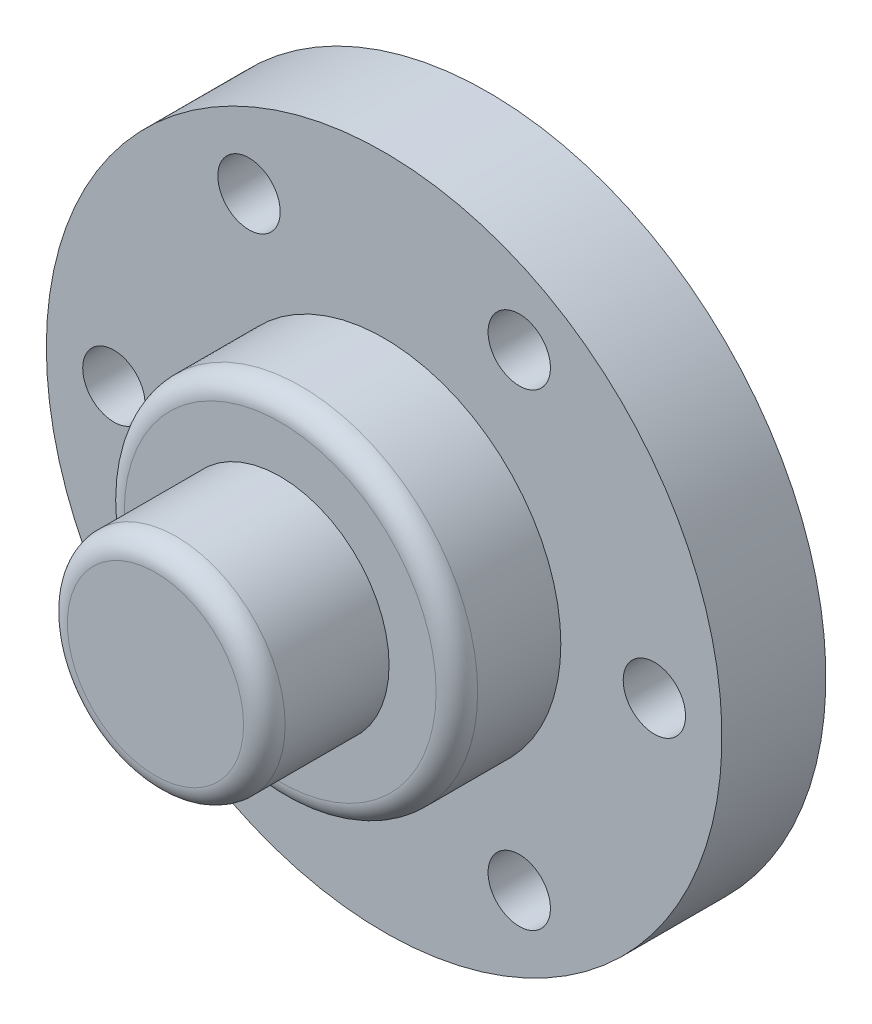
from build123d import *

# Parameters (mm, degrees)
SKETCH1_R           = 17
BOSS_EXTRUDE1_DEPTH = 10
SKETCH2_R           = 10.475
BOSS_EXTRUDE2_DEPTH = 12
FILLET1_R           = 2
SKETCH3_R           = 32.5
BOSS_EXTRUDE3_DEPTH = 10
SKETCH4_R           = 3
CUT_EXTRUDE1_DEPTH  = 57.004464108


with BuildPart() as part:
    # Sketch1 → Boss-Extrude1 (new body)
    with BuildSketch(Plane.XY):
        Circle(SKETCH1_R)
    extrude(amount=BOSS_EXTRUDE1_DEPTH)

    # Sketch2 → Boss-Extrude2 (add)
    with BuildSketch(Plane.XY.offset(10)):
        Circle(SKETCH2_R)
    extrude(amount=BOSS_EXTRUDE2_DEPTH)

    # Fillet1
    fillet1_edges = [part.edges().sort_by_distance(p)[0] for p in [
        (-17, 0, 10),
        (-10.475, 0, 22),
    ]]
    fillet(fillet1_edges, radius=FILLET1_R)

    # Sketch3 → Boss-Extrude3 (add)
    with BuildSketch(Plane(origin=(0, 0, 0), x_dir=(-1, 0, 0), z_dir=(0, 0, -1))):
        Circle(SKETCH3_R)
    extrude(amount=BOSS_EXTRUDE3_DEPTH)

    # Sketch4 → Cut-Extrude1 (cut, through all)
    with BuildSketch(Plane(origin=(0, 0, -10), x_dir=(-1, 0, 0), z_dir=(0, 0, -1))):
        with Locations((26, 0)):
            Circle(SKETCH4_R)
        with Locations((13, -22.516660498)):
            Circle(SKETCH4_R)
        with Locations((-13, -22.516660498)):
            Circle(SKETCH4_R)
        with Locations((-26, 0)):
            Circle(SKETCH4_R)
        with Locations((-13, 22.516660498)):
            Circle(SKETCH4_R)
        with Locations((13, 22.516660498)):
            Circle(SKETCH4_R)
    extrude(amount=-CUT_EXTRUDE1_DEPTH, mode=Mode.SUBTRACT)


solid = part.part
